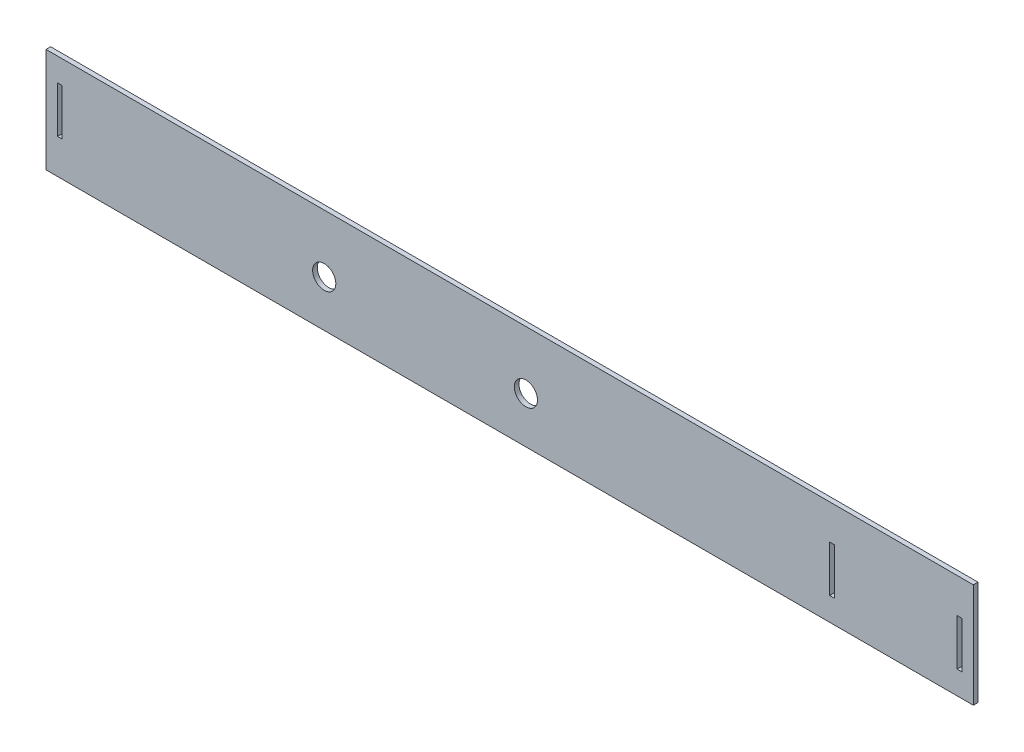
from build123d import *

# Parameters (mm, degrees)
SKETCH_1_W      = 400
SKETCH_1_H      = 45
SKETCH_1_R      = 5
SKETCH_1_W_2    = 2
SKETCH_1_H_2    = 20
EXTRUDE_1_DEPTH = 2


with BuildPart() as part:
    # Эскиз1 → Бобышка-Вытянуть1 (new body)
    with BuildSketch(Plane.XY):
        with Locations((200, 22.5)):
            Rectangle(SKETCH_1_W, SKETCH_1_H)
        with Locations((120, 20)):
            Circle(SKETCH_1_R, mode=Mode.SUBTRACT)
        with Locations((207, 20)):
            Circle(SKETCH_1_R, mode=Mode.SUBTRACT)
        with Locations((339, 20)):
            Rectangle(SKETCH_1_W_2, SKETCH_1_H_2, mode=Mode.SUBTRACT)
        with Locations((6, 25)):
            Rectangle(SKETCH_1_W_2, SKETCH_1_H_2, mode=Mode.SUBTRACT)
        with Locations((394, 20)):
            Rectangle(SKETCH_1_W_2, SKETCH_1_H_2, mode=Mode.SUBTRACT)
    extrude(amount=EXTRUDE_1_DEPTH)


solid = part.part
